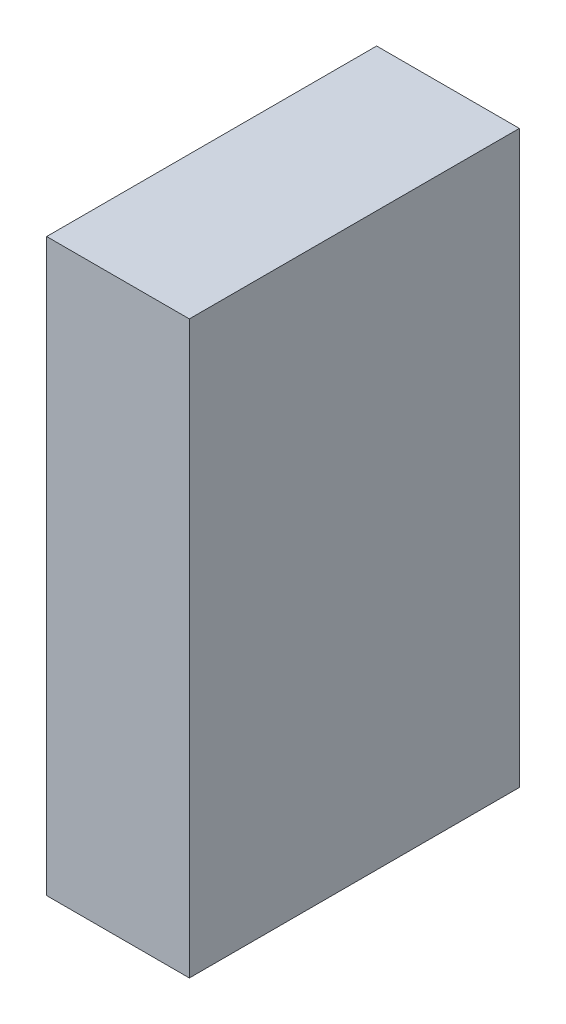
from build123d import *

# Parameters (mm, degrees)
SKETCH1_W           = 38.1
SKETCH1_H           = 88.10625
BOSS_EXTRUDE1_DEPTH = 152.4


with BuildPart() as part:
    # Sketch1 → Boss-Extrude1 (new body)
    with BuildSketch(Plane(origin=(0, 0, 0), x_dir=(1, 0, 0), z_dir=(0, 1, 0))):
        Rectangle(SKETCH1_W, SKETCH1_H)
    extrude(amount=BOSS_EXTRUDE1_DEPTH)


solid = part.part
